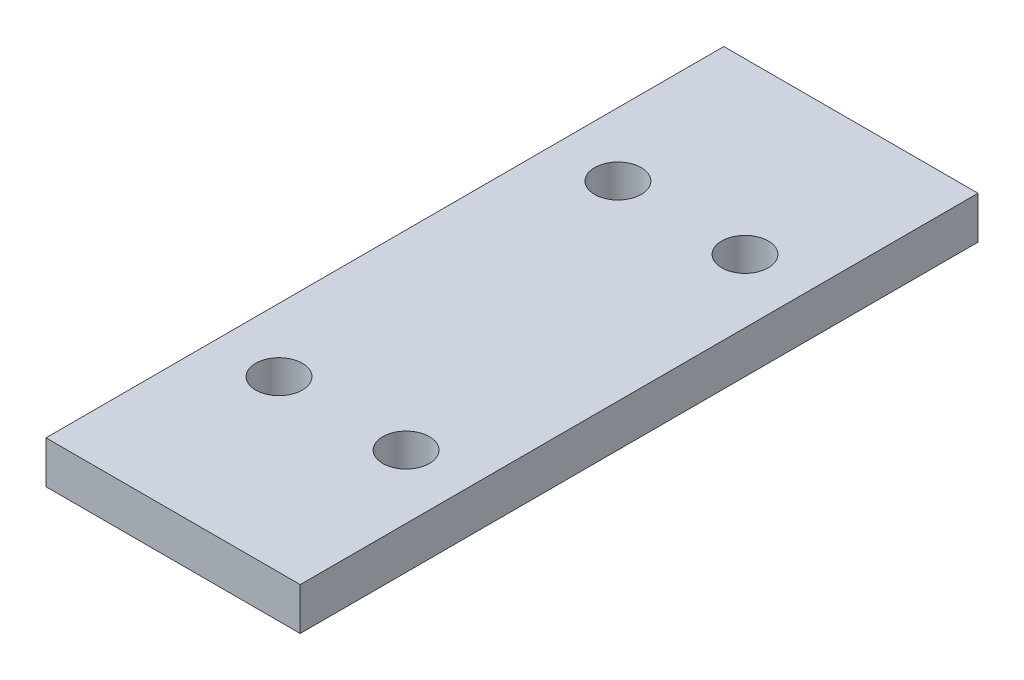
from build123d import *

# Parameters (mm, degrees)
SKETCH1_W           = 38.1
SKETCH1_H           = 101.6
SKETCH1_R           = 3.4925
BOSS_EXTRUDE1_DEPTH = 6.35


with BuildPart() as part:
    # Sketch1 → Boss-Extrude1 (new body)
    with BuildSketch(Plane(origin=(0, 0, 0), x_dir=(1, 0, 0), z_dir=(0, 1, 0))):
        Rectangle(SKETCH1_W, SKETCH1_H)
        with Locations(Location((-9.525, 25.4, 0), (0, 0, 270))):
            Circle(SKETCH1_R, mode=Mode.SUBTRACT)
        with Locations(Location((9.525, 25.4, 0), (0, 0, 270))):
            Circle(SKETCH1_R, mode=Mode.SUBTRACT)
        with Locations(Location((9.525, -25.4, 0), (0, 0, 270))):
            Circle(SKETCH1_R, mode=Mode.SUBTRACT)
        with Locations(Location((-9.525, -25.4, 0), (0, 0, 270))):
            Circle(SKETCH1_R, mode=Mode.SUBTRACT)
    extrude(amount=BOSS_EXTRUDE1_DEPTH)


solid = part.part
